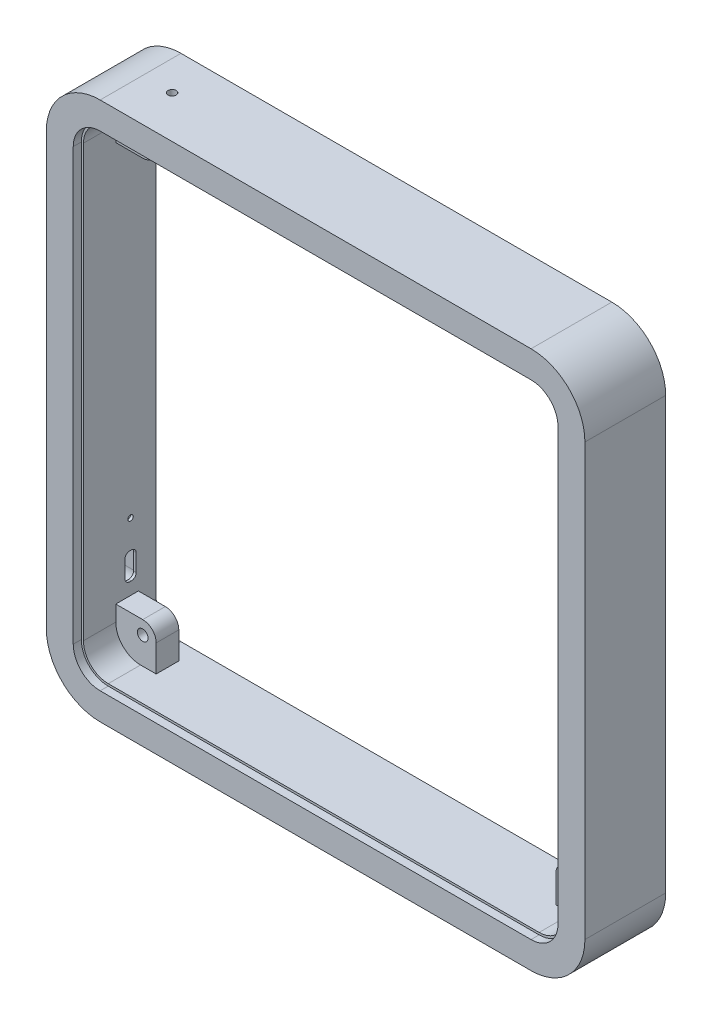
from build123d import *

# Parameters (mm, degrees)
SKETCH2_W                = 200
SKETCH2_H                = 200
BOSS_EXTRUDE1_DEPTH      = 30
FILLET1_R                = 20
CUT_EXTRUDE1_DEPTH       = 3
CUT_EXTRUDE2_DEPTH       = 144.975692393
SKETCH6_W                = 15
SKETCH6_H                = 15
BOSS_EXTRUDE4_DEPTH      = 15
FILLET2_R                = 5
F_4_0_4_DIAMETER_HOLE1_D = 4
CUT_EXTRUDE3_START       = -6.6
CUT_EXTRUDE3_DEPTH       = 6.6
CUT_EXTRUDE4_REACH       = 227.61
SKETCH11_R               = 1.5
SKETCH15_R               = 1
CUT_EXTRUDE5_DEPTH       = 217.094053597
CUT_EXTRUDE7_DEPTH       = 9.8
FILLET3_R                = 1


with BuildPart() as part:
    # Sketch2 → Boss-Extrude1 (new body)
    with BuildSketch(Plane.XY):
        Rectangle(SKETCH2_W, SKETCH2_H)
    extrude(amount=BOSS_EXTRUDE1_DEPTH)

    # Fillet1
    fillet1_edges = [part.edges().sort_by_distance(p)[0] for p in [
        (100, -100, 15),
        (-100, -100, 15),
        (-100, 100, 15),
        (100, 100, 15),
    ]]
    fillet(fillet1_edges, radius=FILLET1_R)

    # Sketch3 → Cut-Extrude1 (cut)
    with BuildSketch(Plane.XY.offset(30)):
        with BuildLine():
            Line((-90, 80), (-90, -80))
            ThreePointArc((-90, -80), (-87.071067812, -87.071067812), (-80, -90))
            Line((-80, -90), (80, -90))
            ThreePointArc((80, -90), (87.071067812, -87.071067812), (90, -80))
            Line((90, -80), (90, 80))
            ThreePointArc((90, 80), (87.071067812, 87.071067812), (80, 90))
            Line((80, 90), (-80, 90))
            ThreePointArc((-80, 90), (-87.071067812, 87.071067812), (-90, 80))
        make_face()
    extrude(amount=-CUT_EXTRUDE1_DEPTH, mode=Mode.SUBTRACT)

    # Sketch4 → Cut-Extrude2 (cut, through all)
    with BuildSketch(Plane.XY.offset(27)):
        with BuildLine():
            Line((-89.2, 80), (-89.2, -80))
            ThreePointArc((-89.2, -80), (-86.505382387, -86.505382387), (-80, -89.2))
            Line((-80, -89.2), (80, -89.2))
            ThreePointArc((80, -89.2), (86.505382387, -86.505382387), (89.2, -80))
            Line((89.2, -80), (89.2, 80))
            ThreePointArc((89.2, 80), (86.505382387, 86.505382387), (80, 89.2))
            Line((80, 89.2), (-80, 89.2))
            ThreePointArc((-80, 89.2), (-86.505382387, 86.505382387), (-89.2, 80))
        make_face()
    extrude(amount=-CUT_EXTRUDE2_DEPTH, mode=Mode.SUBTRACT)

    # Sketch6 → Boss-Extrude4 (add)
    with BuildSketch(Plane(origin=(0, 0, 0), x_dir=(-1, 0, 0), z_dir=(0, 0, -1))):
        with Locations((-81.7, -81.7)):
            Rectangle(SKETCH6_W, SKETCH6_H)
        with Locations((-81.7, 81.7)):
            Rectangle(SKETCH6_W, SKETCH6_H)
        with Locations((81.7, 81.7)):
            Rectangle(SKETCH6_W, SKETCH6_H)
        with Locations((81.7, -81.7)):
            Rectangle(SKETCH6_W, SKETCH6_H)
    extrude(amount=-BOSS_EXTRUDE4_DEPTH)

    # Fillet2
    fillet2_edges = [part.edges().sort_by_distance(p)[0] for p in [
        (74.2, 74.2, 7.5),
        (-74.2, 74.2, 7.5),
        (-74.2, -74.2, 7.5),
        (74.2, -74.2, 7.5),
    ]]
    fillet(fillet2_edges, radius=FILLET2_R)

    # Ø4.0 (4) Diameter Hole1 (through all)
    with Locations(Plane(origin=(0, 0, 0), x_dir=(-1, 0, 0), z_dir=(0, 0, -1))):
        with Locations((-79.2, 79.2), (79.2, 79.2), (-79.2, -79.2), (79.2, -79.2)):
            Hole(F_4_0_4_DIAMETER_HOLE1_D / 2)

    # Sketch10 → Cut-Extrude3 (cut)
    with BuildSketch(Plane(origin=(0, 0, 0), x_dir=(-1, 0, 0), z_dir=(0, 0, -1)).offset(CUT_EXTRUDE3_START)):
        with BuildLine():
            Line((89.2, -80), (89.2, 80))
            ThreePointArc((89.2, 80), (86.505382387, 86.505382387), (80, 89.2))
            Line((80, 89.2), (-80, 89.2))
            ThreePointArc((-80, 89.2), (-86.505382387, 86.505382387), (-89.2, 80))
            Line((-89.2, 80), (-89.2, -80))
            ThreePointArc((-89.2, -80), (-86.505382387, -86.505382387), (-80, -89.2))
            Line((-80, -89.2), (80, -89.2))
            ThreePointArc((80, -89.2), (86.505382387, -86.505382387), (89.2, -80))
        make_face()
    extrude(amount=CUT_EXTRUDE3_DEPTH, mode=Mode.SUBTRACT)

    # Sketch11 → Cut-Extrude4 (cut, up to next)
    with BuildSketch(Plane(origin=(0, 100, 0), x_dir=(1, 0, 0), z_dir=(0, 1, 0)), mode=Mode.PRIVATE) as cut_extrude4_sk1:
        with Locations(Location((-68.95500318, -14.324851484, 0), (0, 0, 270))):
            Circle(SKETCH11_R)
    cut_extrude4_tool1 = extrude(cut_extrude4_sk1.sketch, amount=-CUT_EXTRUDE4_REACH, mode=Mode.PRIVATE) & part.part
    add(cut_extrude4_tool1.solids().sort_by_distance((-68.955003, 100, 14.324851))[0], mode=Mode.SUBTRACT)

    # Sketch15 → Cut-Extrude5 (cut, through all)
    with BuildSketch(Plane(origin=(-89.2, 0, 0), x_dir=(0, 0, -1), z_dir=(1, 0, 0))):
        with Locations((-9.506010444, -49.23845191)):
            Circle(SKETCH15_R)
        with BuildLine():
            Line((-9.226010444, -59.688663791), (-9.786010444, -59.688663791))
            ThreePointArc((-9.786010444, -59.688663791), (-11.05880265, -60.215871585), (-11.586010444, -61.488663791))
            Line((-11.586010444, -61.488663791), (-11.586010444, -67.838663791))
            ThreePointArc((-11.586010444, -67.838663791), (-11.05880265, -69.111455997), (-9.786010444, -69.638663791))
            Line((-9.786010444, -69.638663791), (-9.226010444, -69.638663791))
            ThreePointArc((-9.226010444, -69.638663791), (-7.953218238, -69.111455997), (-7.426010444, -67.838663791))
            Line((-7.426010444, -67.838663791), (-7.426010444, -61.488663791))
            ThreePointArc((-7.426010444, -61.488663791), (-7.953218238, -60.215871585), (-9.226010444, -59.688663791))
        make_face()
    extrude(amount=-CUT_EXTRUDE5_DEPTH, mode=Mode.SUBTRACT)

    # Sketch17 → Cut-Extrude7 (cut)
    with BuildSketch(Plane.ZY.offset(100)):
        with BuildLine():
            Line((20.850135553, -38.354466572), (7.5, -38.354466572))
            ThreePointArc((7.5, -38.354466572), (3.964466094, -39.818932666), (2.5, -43.354466572))
            Line((2.5, -43.354466572), (2.5, -72.5))
            ThreePointArc((2.5, -72.5), (3.964466094, -76.035533906), (7.5, -77.5))
            Line((7.5, -77.5), (20.850135553, -77.5))
            ThreePointArc((20.850135553, -77.5), (24.385669459, -76.035533906), (25.850135553, -72.5))
            Line((25.850135553, -72.5), (25.850135553, -43.354466572))
            ThreePointArc((25.850135553, -43.354466572), (24.385669459, -39.818932666), (20.850135553, -38.354466572))
        make_face()
    extrude(amount=-CUT_EXTRUDE7_DEPTH, mode=Mode.SUBTRACT)

    # Fillet3
    fillet3_edges = [part.edges().sort_by_distance(p)[0] for p in [
        (-100, -39.818932666, 3.964466094),
        (-100, -57.927233286, 2.5),
        (-100, -76.035533906, 3.964466094),
        (-100, -77.5, 14.175067777),
        (-100, -76.035533906, 24.385669459),
        (-100, -57.927233286, 25.850135553),
        (-100, -39.818932666, 24.385669459),
        (-100, -38.354466572, 14.175067777),
        (-90.2, -39.818932666, 3.964466094),
        (-90.2, -38.354466572, 14.175067777),
        (-90.2, -39.818932666, 24.385669459),
        (-90.2, -57.927233286, 25.850135553),
        (-90.2, -76.035533906, 24.385669459),
        (-90.2, -77.5, 14.175067777),
        (-90.2, -76.035533906, 3.964466094),
        (-90.2, -57.927233286, 2.5),
    ]]
    fillet(fillet3_edges, radius=FILLET3_R)


solid = part.part
